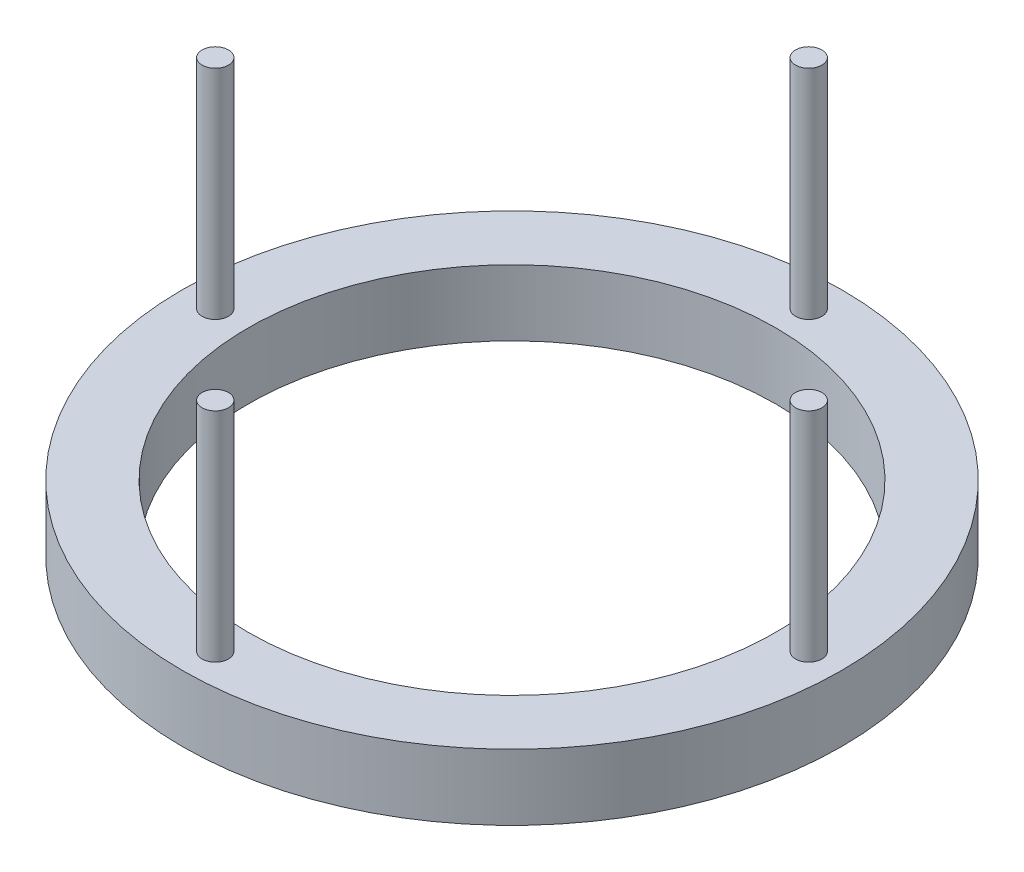
from build123d import *

# Parameters (mm, degrees)
SKETCH1_R           = 50
SKETCH1_R_2         = 40
BOSS_EXTRUDE1_DEPTH = 10
SKETCH2_R           = 2
BOSS_EXTRUDE2_DEPTH = 33
CIRPATTERN1_COUNT   = 4


with BuildPart() as part:
    # Sketch1 → Boss-Extrude1 (new body)
    with BuildSketch(Plane(origin=(0, 0, 0), x_dir=(1, 0, 0), z_dir=(0, 1, 0))):
        Circle(SKETCH1_R)
        Circle(SKETCH1_R_2, mode=Mode.SUBTRACT)
    extrude(amount=BOSS_EXTRUDE1_DEPTH)

    # Sketch2 → Boss-Extrude2 (add)
    with BuildSketch(Plane(origin=(0, 10, 0), x_dir=(1, 0, 0), z_dir=(0, 1, 0))):
        with Locations((0, 45)):
            Circle(SKETCH2_R)
    boss_extrude2 = extrude(amount=BOSS_EXTRUDE2_DEPTH)

    # CirPattern1: Boss-Extrude2 ×4 about axis
    cirpattern1_axis = Axis((0, 10, 0), (0, 1, 0))
    for i in range(1, CIRPATTERN1_COUNT):
        add(boss_extrude2.rotate(cirpattern1_axis, i * 360 / CIRPATTERN1_COUNT))


solid = part.part
